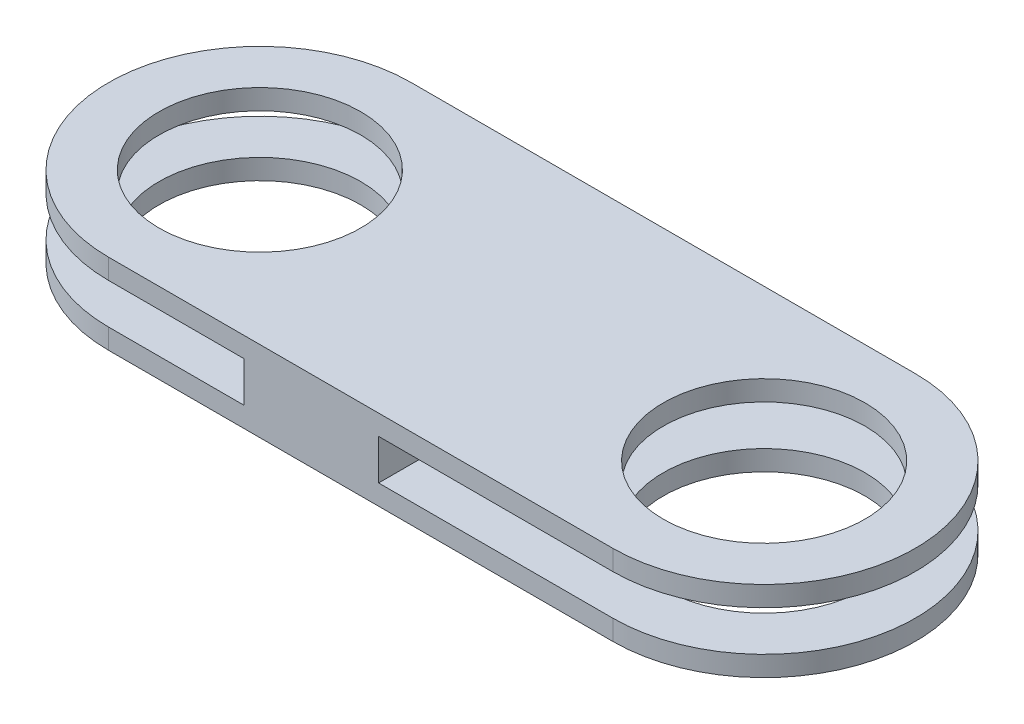
from build123d import *

# Parameters (mm, degrees)
SKETCH_1_R      = 10
EXTRUDE_1_DEPTH = 2
SKETCH_2_W      = 13.356704287
SKETCH_2_H      = 30
EXTRUDE_2_DEPTH = 2


with BuildPart() as part:
    # 草图1 → 凸台-拉伸1 (new body)
    with BuildSketch(Plane(origin=(0, 0, 0), x_dir=(1, 0, 0), z_dir=(0, 1, 0))):
        with BuildLine():
            Line((0, 15), (50, 15))
            ThreePointArc((50, 15), (65, 0), (50, -15))
            Line((50, -15), (0, -15))
            ThreePointArc((0, -15), (-15, 0), (0, 15))
        make_face()
        with Locations(Location((0, 0, 0), (0, 0, 270))):
            Circle(SKETCH_1_R, mode=Mode.SUBTRACT)
        with Locations(Location((50, 0, 0), (0, 0, 270))):
            Circle(SKETCH_1_R, mode=Mode.SUBTRACT)
    extrude_1 = extrude(amount=EXTRUDE_1_DEPTH)

    # 草图2 → 凸台-拉伸2 (add)
    with BuildSketch(Plane(origin=(0, 2, 0), x_dir=(1, 0, 0), z_dir=(0, 1, 0))):
        with Locations((20.097558378, 0)):
            Rectangle(SKETCH_2_W, SKETCH_2_H)
    extrude_2 = extrude(amount=EXTRUDE_2_DEPTH)

    # 镜向1: 凸台-拉伸1, 凸台-拉伸2 across plane
    add(extrude_1.mirror(Plane.ZX.offset(4)))
    add(extrude_2.mirror(Plane.ZX.offset(4)))


solid = part.part
